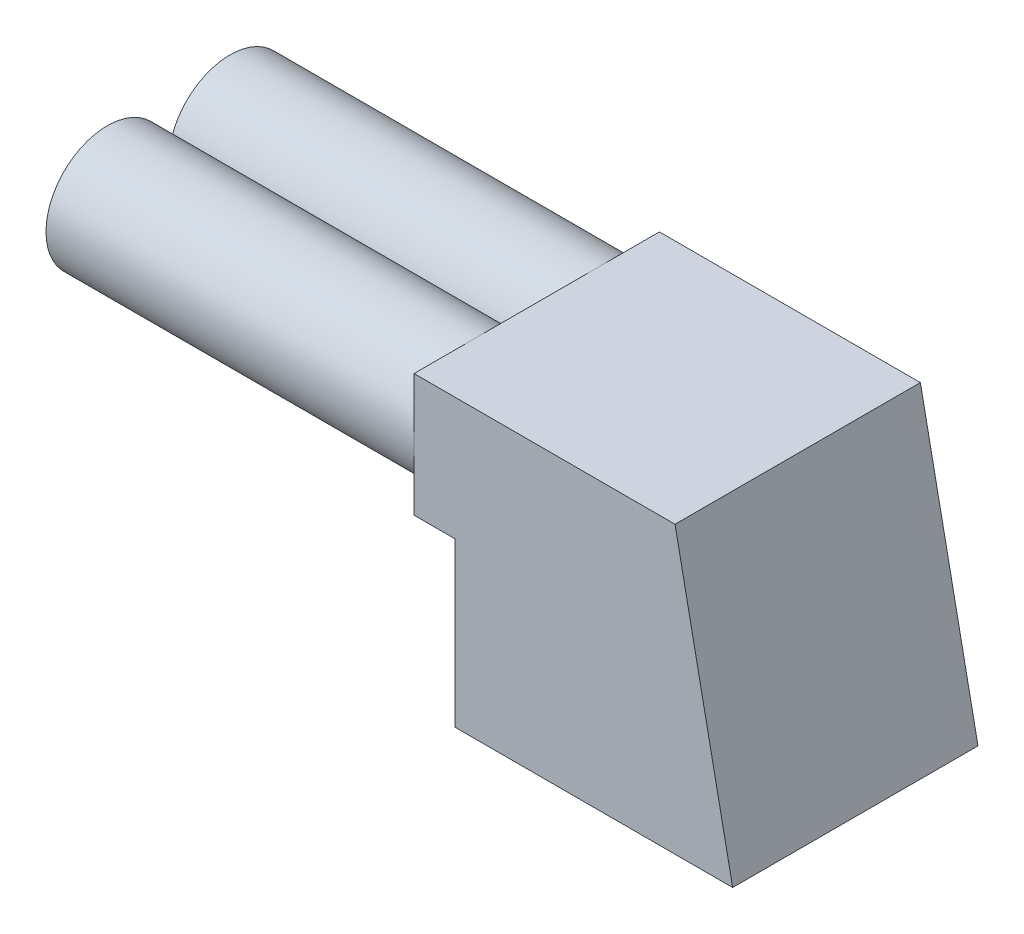
from build123d import *

# Parameters (mm, degrees)
ESTRUSIONE_ESTRUSIONE1_DEPTH      = 30
ESTRUSIONE_ESTRUSIONE1_DEPTH_BACK = 30
ESTRUSIONE_ESTRUSIONE2_DEPTH      = 100
SCHIZZO4_W                        = 60
SCHIZZO4_H                        = 30
ESTRUSIONE_ESTRUSIONE3_DEPTH      = 10


with BuildPart() as part:
    # Schizzo2 → Estrusione-Estrusione1 (new, two sides: drawn at the far end of the back side and taken through both)
    with BuildSketch(Plane.XY.offset(-ESTRUSIONE_ESTRUSIONE1_DEPTH_BACK)):
        Polygon((-27.055755895, 0), (40.865464632, 0), (26.773925104, 69.894036061), (-27.055755895, 69.894036061), align=None)
    extrude(amount=ESTRUSIONE_ESTRUSIONE1_DEPTH + ESTRUSIONE_ESTRUSIONE1_DEPTH_BACK)

    # Schizzo3 → Estrusione-Estrusione2 (add)
    with BuildSketch(Plane.ZY.offset(27.055755895)):
        with BuildLine():
            Line((-0.013660109, 55.534049081), (0.013660109, 55.534049081))
            ThreePointArc((0.013660109, 55.534049081), (29.99975309, 54.980101414), (0.021991114, 54.082094061))
            Line((0.021991114, 54.082094061), (-0.021991114, 54.082094061))
            ThreePointArc((-0.021991114, 54.082094061), (-29.99975309, 54.980101414), (-0.013660109, 55.534049081))
        make_face()
    extrude(amount=ESTRUSIONE_ESTRUSIONE2_DEPTH)

    # Schizzo4 → Estrusione-Estrusione3 (add)
    with BuildSketch(Plane.ZY.offset(27.055755895)):
        with Locations((0, 54.894036061)):
            Rectangle(SCHIZZO4_W, SCHIZZO4_H)
    extrude(amount=ESTRUSIONE_ESTRUSIONE3_DEPTH)


solid = part.part
